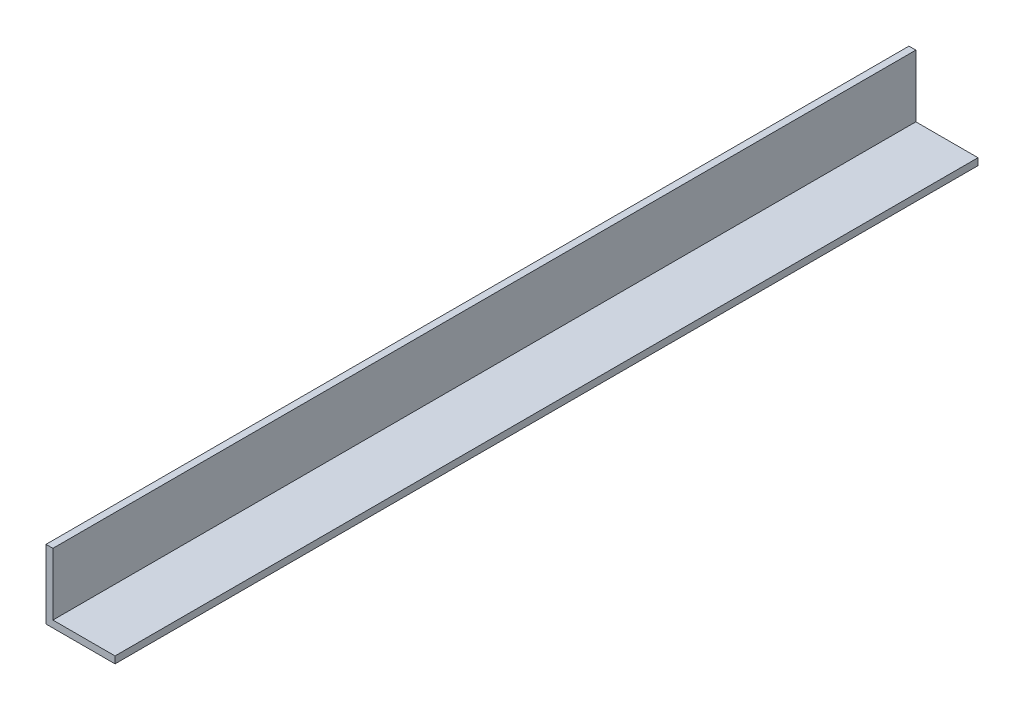
from build123d import *

# Parameters (mm, degrees)
EXTRUDE_1_DEPTH = 500


with BuildPart() as part:
    # Эскиз1 → Бобышка-Вытянуть1 (new body)
    with BuildSketch(Plane.XY):
        Polygon((0, 0), (0, 40), (4, 40), (4, 4), (40, 4), (40, 0), align=None)
    extrude(amount=EXTRUDE_1_DEPTH)


solid = part.part
